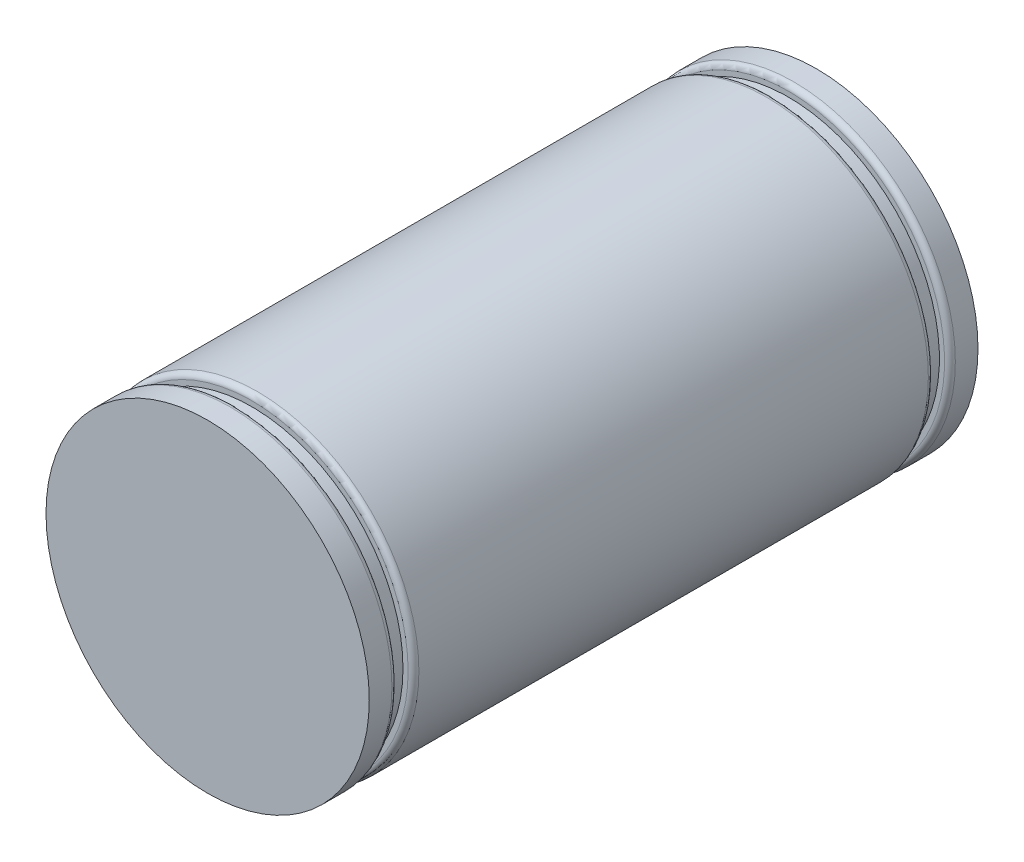
from build123d import *

# Parameters (mm, degrees)
BOSS_EXTRUDE1_DEPTH      = 24.1
BOSS_EXTRUDE1_DEPTH_BACK = 24.1
SKETCH1_R                = 14.975
SKETCH2_R                = 14
BOSS_EXTRUDE2_DEPTH      = 1.5
SKETCH3_R                = 14.975
BOSS_EXTRUDE3_DEPTH      = 2.6
BOSS_EXTRUDE4_START      = 1.5
SKETCH4_R                = 14
BOSS_EXTRUDE4_DEPTH      = 1.5
BOSS_EXTRUDE5_START      = 2.6
SKETCH5_R                = 14.975
BOSS_EXTRUDE5_DEPTH      = 2.6
FILLET1_R                = 0.5
FILLET3_R                = 0.5


with BuildPart() as part:
    # Sketch1 → Boss-Extrude1 (new, two sides: drawn at the far end of the back side and taken through both)
    with BuildSketch(Plane.XY.offset(-BOSS_EXTRUDE1_DEPTH_BACK)):
        Circle(SKETCH1_R)
    extrude(amount=BOSS_EXTRUDE1_DEPTH + BOSS_EXTRUDE1_DEPTH_BACK)

    # Sketch2 → Boss-Extrude2 (add)
    with BuildSketch(Plane.XY.offset(24.1)):
        Circle(SKETCH2_R)
    extrude(amount=BOSS_EXTRUDE2_DEPTH)

    # Sketch3 → Boss-Extrude3 (add)
    with BuildSketch(Plane.XY.offset(25.6)):
        Circle(SKETCH3_R)
    extrude(amount=BOSS_EXTRUDE3_DEPTH)

    # Sketch4 → Boss-Extrude4 (add)
    with BuildSketch(Plane(origin=(0, 0, -24.1), x_dir=(-1, 0, 0), z_dir=(0, 0, -1)).offset(BOSS_EXTRUDE4_START)):
        Circle(SKETCH4_R)
    extrude(amount=-BOSS_EXTRUDE4_DEPTH)

    # Sketch5 → Boss-Extrude5 (add)
    with BuildSketch(Plane(origin=(0, 0, -25.6), x_dir=(-1, 0, 0), z_dir=(0, 0, -1)).offset(BOSS_EXTRUDE5_START)):
        Circle(SKETCH5_R)
    extrude(amount=-BOSS_EXTRUDE5_DEPTH)

    # Fillet1
    fillet1_edges = [part.edges().sort_by_distance(p)[0] for p in [
        (-14.975, 0, 25.6),
    ]]
    fillet(fillet1_edges, radius=FILLET1_R)

    # Fillet3
    fillet3_edges = [part.edges().sort_by_distance(p)[0] for p in [
        (14.975, 0, -25.6),
        (-14.975, 0, -24.1),
        (-14.975, 0, 24.1),
    ]]
    fillet(fillet3_edges, radius=FILLET3_R)


solid = part.part
